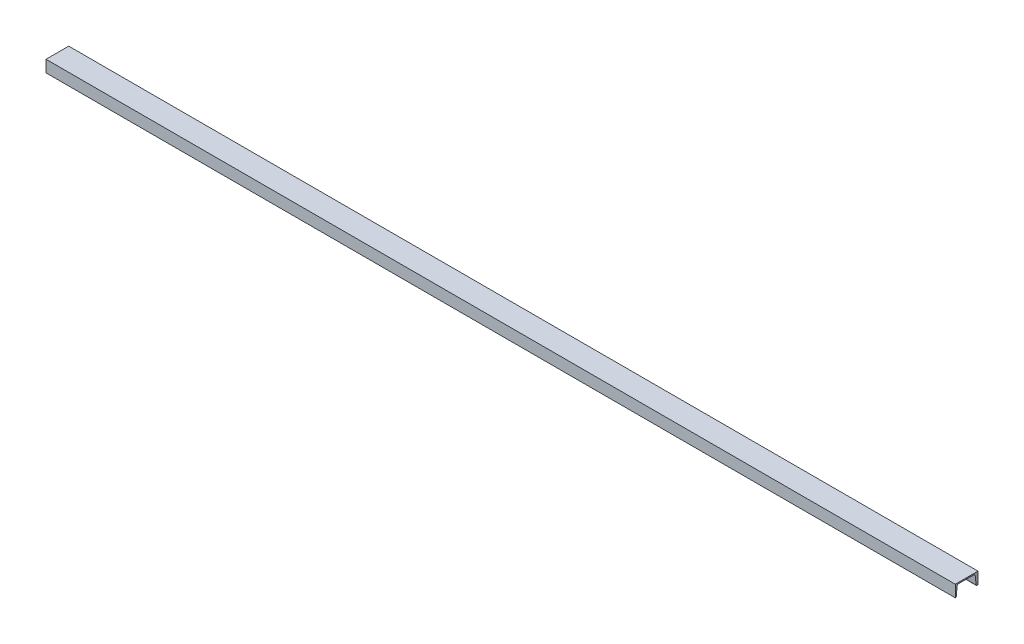
from build123d import *

# Parameters (mm, degrees)
C_CHANNEL_120_X_12_1_DEPTH = 5005


with BuildPart() as part:
    # Sketch11 → C channel 120 X 12(1) (new body)
    with BuildSketch(Plane(origin=(0, 0, 0), x_dir=(0, -1, 0), z_dir=(-1, 0, 0))):
        with BuildLine():
            Line((65, 125), (0, 125))
            Line((0, 125), (0, 0))
            Line((0, 0), (65, 0))
            Line((65, 0), (65, 5.845330836))
            ThreePointArc((65, 5.845330836), (63.844151715, 8.856418565), (60.970378085, 10.320679365))
            Line((60.970378085, 10.320679365), (13.463772294, 15.313824837))
            ThreePointArc((13.463772294, 15.313824837), (8.354841396, 17.916955149), (6.3, 23.27))
            Line((6.3, 23.27), (6.3, 106.74))
            ThreePointArc((6.3, 106.74), (8.354841396, 112.093044851), (13.463772294, 114.696175163))
            Line((13.463772294, 114.696175163), (60.970378085, 119.689320635))
            ThreePointArc((60.970378085, 119.689320635), (63.844151715, 121.153581435), (65, 124.164669164))
            Line((65, 124.164669164), (65, 125))
        make_face()
    extrude(amount=C_CHANNEL_120_X_12_1_DEPTH)


solid = part.part
